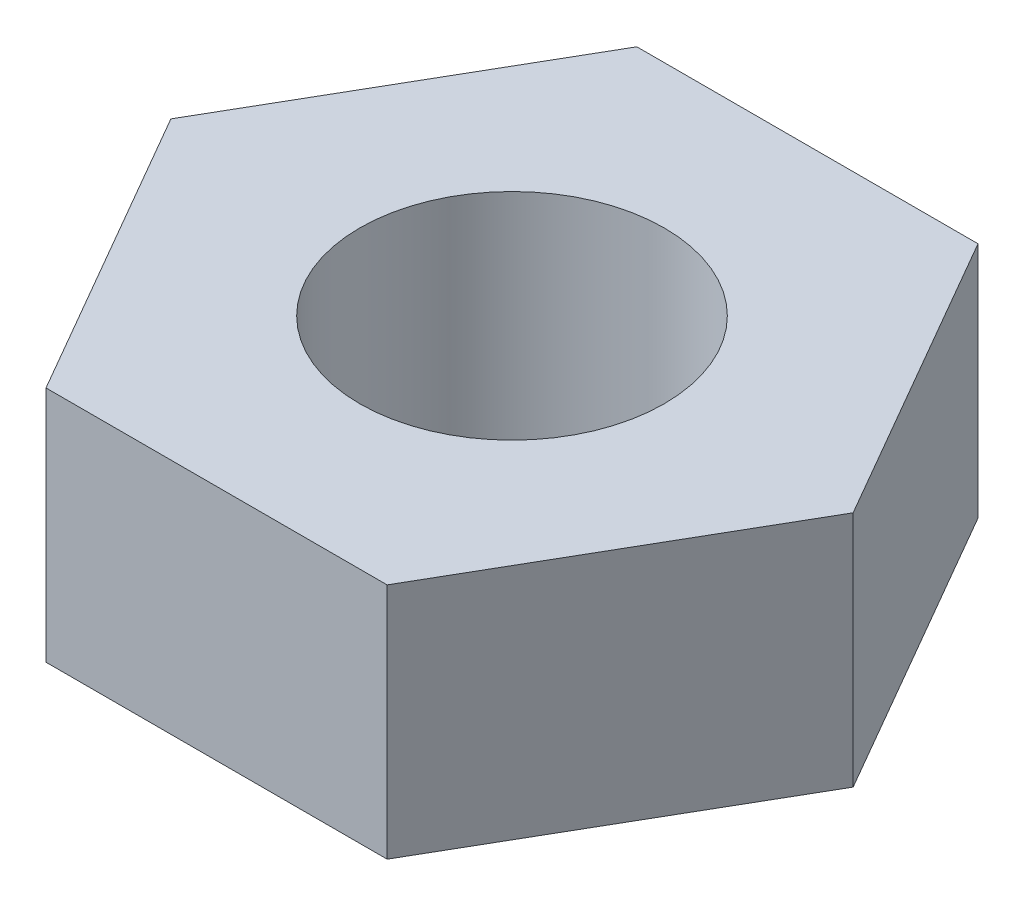
from build123d import *

# Parameters (mm, degrees)
SKETCH2_R           = 1.25
BOSS_EXTRUDE1_DEPTH = 1.95


with BuildPart() as part:
    # Sketch2 → Boss-Extrude1 (new body)
    with BuildSketch(Plane(origin=(0, 0, 0), x_dir=(1, 0, 0), z_dir=(0, 1, 0))):
        Polygon((1.400074403, -2.425), (2.800148806, 0), (1.400074403, 2.425), (-1.400074403, 2.425), (-2.800148806, 0), (-1.400074403, -2.425), align=None)
        with Locations(Location((0, 0, 0), (0, 0, 270))):
            Circle(SKETCH2_R, mode=Mode.SUBTRACT)
    extrude(amount=BOSS_EXTRUDE1_DEPTH)


solid = part.part
